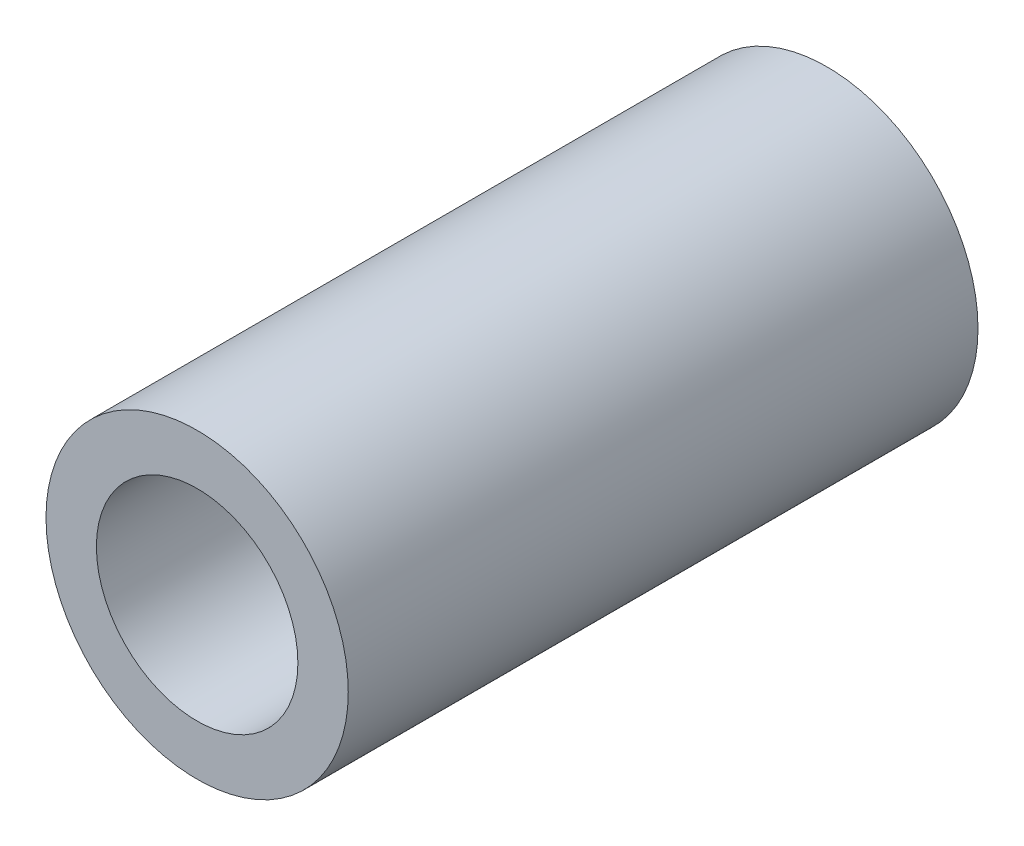
from build123d import *

# Parameters (mm, degrees)
SKETCH1_R           = 2.4
SKETCH1_R_2         = 1.6
BOSS_EXTRUDE1_DEPTH = 10


with BuildPart() as part:
    # Sketch1 → Boss-Extrude1 (new body)
    with BuildSketch(Plane.XY):
        Circle(SKETCH1_R)
        Circle(SKETCH1_R_2, mode=Mode.SUBTRACT)
    extrude(amount=BOSS_EXTRUDE1_DEPTH)


solid = part.part
